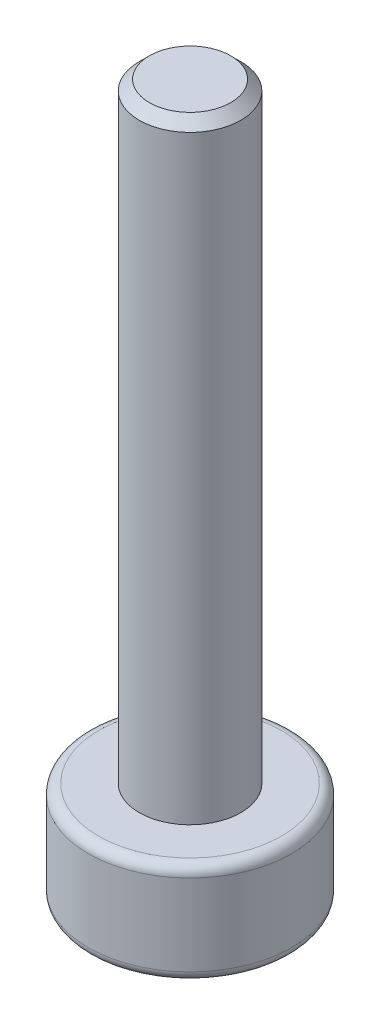
from build123d import *

# Parameters (mm, degrees)
SKETCH_2_R          = 2
EXTRUDE_1_DEPTH     = 2
SKETCH_3_R          = 1
EXTRUDE_2_DEPTH     = 12
FILLET_1_R          = 0.2
SKETCH_4_R          = 0.765
CUT_EXTRUDE_1_DEPTH = 1.52
CHAMFER_1_SIZE      = 0.1
CHAMFER_2_SIZE      = 0.2


with BuildPart() as part:
    # 草图2 → 凸台-拉伸1 (new body)
    with BuildSketch(Plane(origin=(0, 0, 0), x_dir=(1, 0, 0), z_dir=(0, 1, 0))):
        with Locations(Location((0, 0, 0), (0, 0, 270))):
            Circle(SKETCH_2_R)
    extrude(amount=EXTRUDE_1_DEPTH)

    # 草图3 → 凸台-拉伸2 (add)
    with BuildSketch(Plane(origin=(0, 2, 0), x_dir=(1, 0, 0), z_dir=(0, 1, 0))):
        with Locations(Location((0, 0, 0), (0, 0, 270))):
            Circle(SKETCH_3_R)
    extrude(amount=EXTRUDE_2_DEPTH)

    # 圆角1
    fillet_1_edges = [part.edges().sort_by_distance(p)[0] for p in [
        (0, 0, -2),
        (0, 2, -2),
    ]]
    fillet(fillet_1_edges, radius=FILLET_1_R)

    # 草图4 → 切除-拉伸1 (cut)
    with BuildSketch(Plane.XZ):
        with Locations(Location((0, 0, 0), (0, 0, 270))):
            Circle(SKETCH_4_R)
    extrude(amount=-CUT_EXTRUDE_1_DEPTH, mode=Mode.SUBTRACT)

    # 倒角1
    chamfer_1_edges = [part.edges().sort_by_distance(p)[0] for p in [
        (0, 0, 0.765),
    ]]
    chamfer(chamfer_1_edges, length=CHAMFER_1_SIZE)

    # 倒角2
    chamfer_2_edges = [part.edges().sort_by_distance(p)[0] for p in [
        (0, 14, -1),
    ]]
    chamfer(chamfer_2_edges, length=CHAMFER_2_SIZE)


solid = part.part
